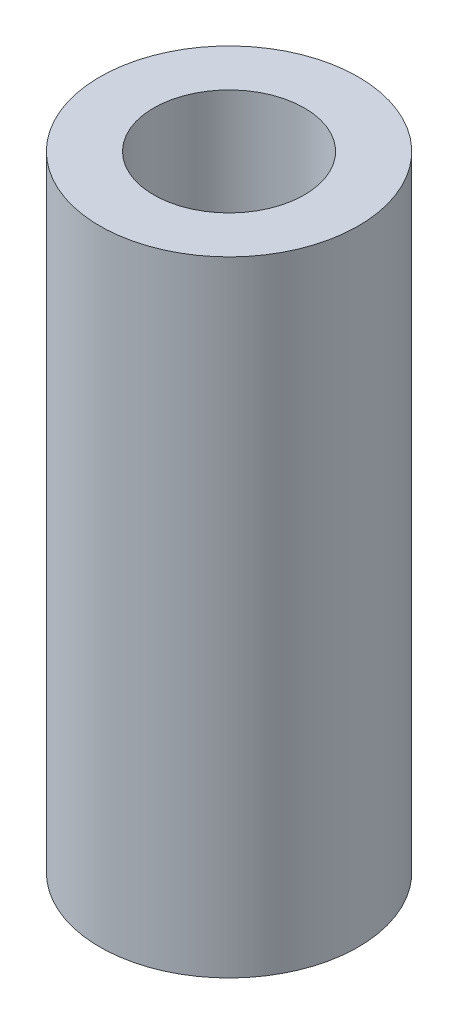
from build123d import *

# Parameters (mm, degrees)
SKETCH1_R           = 6
SKETCH1_R_2         = 3.5
BOSS_EXTRUDE1_DEPTH = 29


with BuildPart() as part:
    # Sketch1 → Boss-Extrude1 (new body)
    with BuildSketch(Plane(origin=(0, 0, 0), x_dir=(1, 0, 0), z_dir=(0, 1, 0))):
        with Locations(Location((0, 0, 0), (0, 0, 90))):
            Circle(SKETCH1_R)
        with Locations(Location((0, 0, 0), (0, 0, 90))):
            Circle(SKETCH1_R_2, mode=Mode.SUBTRACT)
    extrude(amount=BOSS_EXTRUDE1_DEPTH)


solid = part.part
